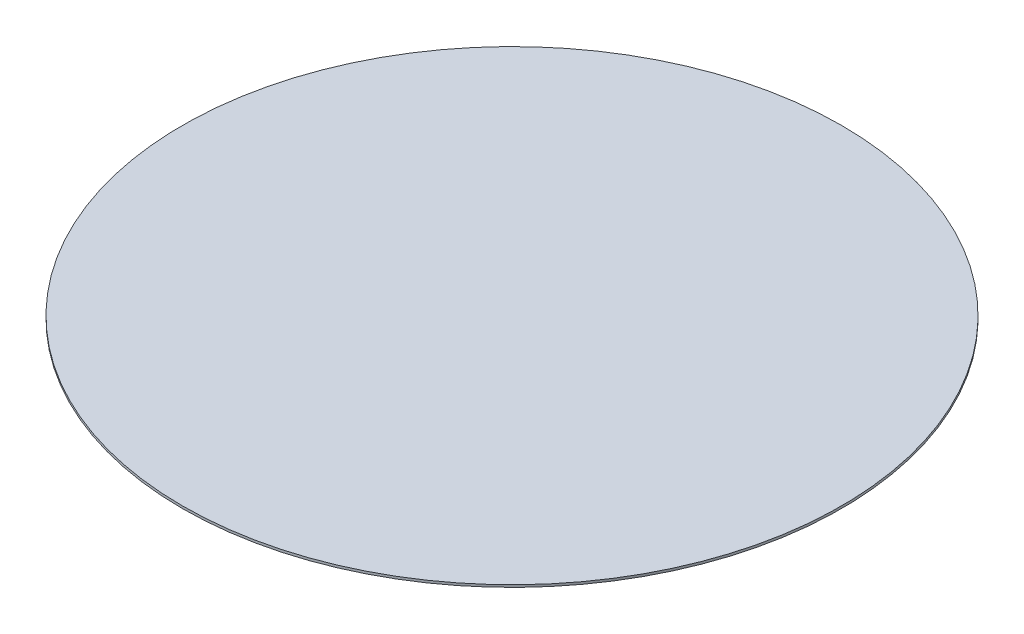
from build123d import *

# Parameters (mm, degrees)
SKETCH1_R           = 140
BOSS_EXTRUDE1_DEPTH = 1


with BuildPart() as part:
    # Sketch1 → Boss-Extrude1 (new body)
    with BuildSketch(Plane(origin=(0, 0, 0), x_dir=(1, 0, 0), z_dir=(0, 1, 0))):
        with Locations(Location((0, 0, 0), (0, 0, 270))):
            Circle(SKETCH1_R)
    extrude(amount=BOSS_EXTRUDE1_DEPTH)


solid = part.part
